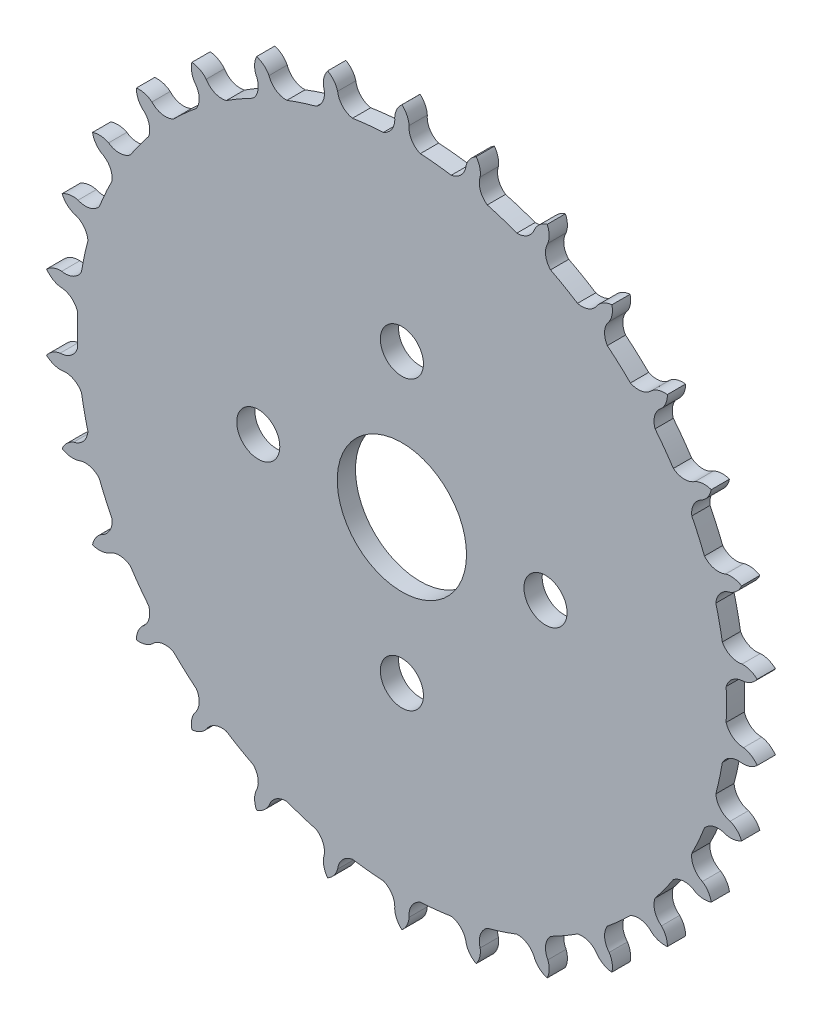
from build123d import *

# Parameters (mm, degrees)
SKETCH1_R           = 22.6042
SKETCH1_R_2         = 1.5
SKETCH1_R_3         = 4.5
BOSS_EXTRUDE2_DEPTH = 1.27
BOSS_EXTRUDE4_DEPTH = 1.27
CIRPATTERN1_COUNT   = 30


with BuildPart() as part:
    # Sketch1 → Boss-Extrude2 (new body)
    with BuildSketch(Plane.XY):
        Circle(SKETCH1_R)
        with Locations((0, 10)):
            Circle(SKETCH1_R_2, mode=Mode.SUBTRACT)
        Circle(SKETCH1_R_3, mode=Mode.SUBTRACT)
        with Locations((10, 0)):
            Circle(SKETCH1_R_2, mode=Mode.SUBTRACT)
        with Locations((0, -10)):
            Circle(SKETCH1_R_2, mode=Mode.SUBTRACT)
        with Locations((-10, 0)):
            Circle(SKETCH1_R_2, mode=Mode.SUBTRACT)
    extrude(amount=BOSS_EXTRUDE2_DEPTH)

    # Sketch2 → Boss-Extrude4 (add)
    with BuildSketch(Plane.XY.offset(1.27)):
        with BuildLine():
            ThreePointArc((0, 24.8732), (-0.350896896, 24.420773343), (-0.499962578, 23.867964213))
            ThreePointArc((-0.499962578, 23.867964213), (-0.781959135, 22.937753007), (-1.639119464, 22.479396033))
            ThreePointArc((-1.639119464, 22.479396033), (0, 22.337103215), (1.639119464, 22.479396033))
            ThreePointArc((1.639119464, 22.479396033), (0.781959135, 22.937753007), (0.499962578, 23.867964213))
            ThreePointArc((0.499962578, 23.867964213), (0.350896896, 24.420773343), (0, 24.8732))
        make_face()
    boss_extrude4 = extrude(amount=-BOSS_EXTRUDE4_DEPTH)

    # CirPattern1: Boss-Extrude4 ×30 about axis
    cirpattern1_axis = Axis((0, 0, 0), (0, 0, 1))
    for i in range(1, CIRPATTERN1_COUNT):
        add(boss_extrude4.rotate(cirpattern1_axis, i * 360 / CIRPATTERN1_COUNT))


solid = part.part
